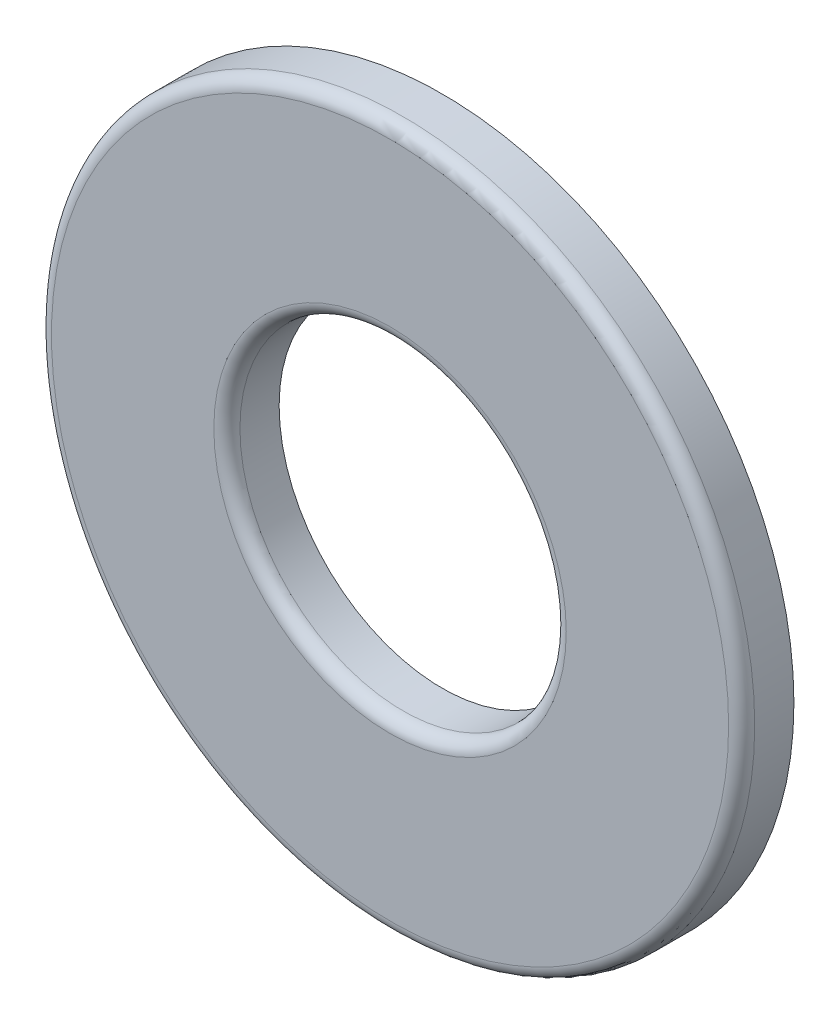
from build123d import *

# Parameters (mm, degrees)
BOSS_EXTRUDE1_DEPTH      = 0.41275
BOSS_EXTRUDE1_DEPTH_BACK = 0.41275
SKETCH3_R                = 5.55625
SKETCH3_R_2              = 2.5781
FILLET1_R                = 0.206375


with BuildPart() as part:
    # Sketch3 → Boss-Extrude1 (new, two sides: drawn at the far end of the back side and taken through both)
    with BuildSketch(Plane.XY.offset(-BOSS_EXTRUDE1_DEPTH_BACK)):
        with Locations(Location((0, 0, 0), (0, 0, 180))):
            Circle(SKETCH3_R)
        with Locations(Location((0, 0, 0), (0, 0, 180))):
            Circle(SKETCH3_R_2, mode=Mode.SUBTRACT)
    extrude(amount=BOSS_EXTRUDE1_DEPTH + BOSS_EXTRUDE1_DEPTH_BACK)

    # Fillet1
    fillet1_edges = [part.edges().sort_by_distance(p)[0] for p in [
        (5.55625, 0, 0.41275),
        (2.5781, 0, 0.41275),
    ]]
    fillet(fillet1_edges, radius=FILLET1_R)


solid = part.part
